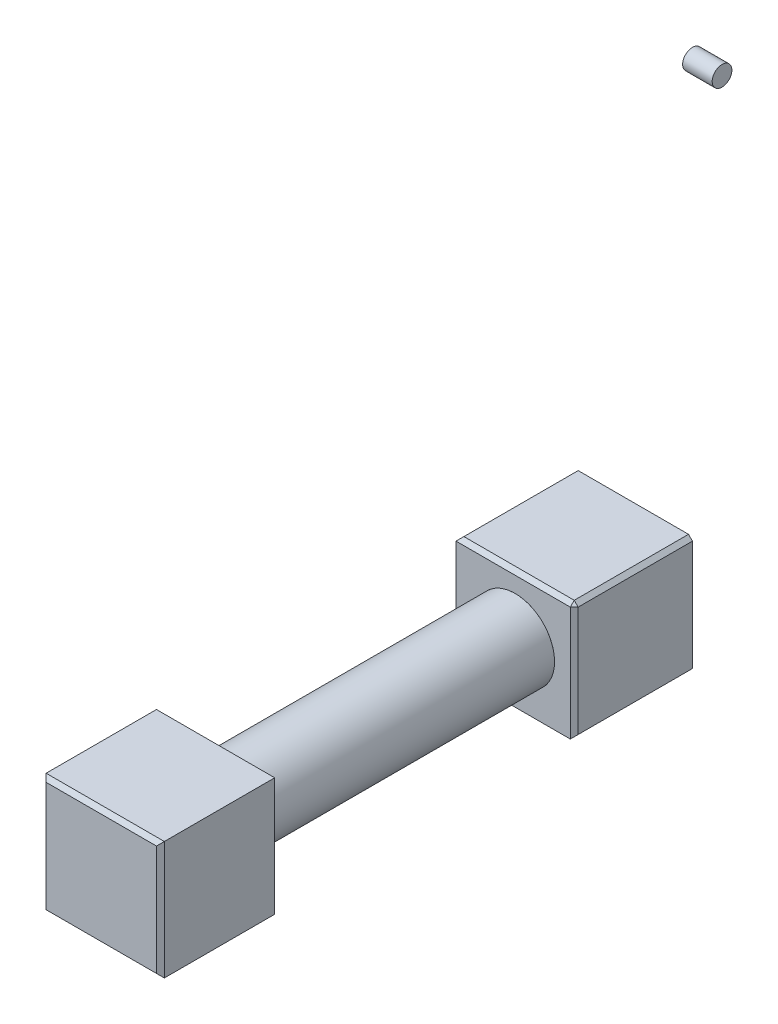
from build123d import *

# Parameters (mm, degrees)
SKETCH1_W           = 60
SKETCH1_H           = 60
BOSS_EXTRUDE1_DEPTH = 60
SKETCH2_R           = 20
CUT_EXTRUDE1_DEPTH  = 61
SKETCH3_R           = 20
BOSS_EXTRUDE2_DEPTH = 150
SKETCH4_W           = 60
SKETCH4_H           = 60
BOSS_EXTRUDE3_DEPTH = 60
CHAMFER1_SIZE       = 2
CHAMFER3_SIZE       = 2
SKETCH5_R           = 5
BOSS_EXTRUDE4_DEPTH = 15


with BuildPart() as part:
    # Sketch1 → Boss-Extrude1 (new body)
    with BuildSketch(Plane.XY):
        Rectangle(SKETCH1_W, SKETCH1_H)
    extrude(amount=BOSS_EXTRUDE1_DEPTH)

    # Sketch2 → Cut-Extrude1 (cut)
    with BuildSketch(Plane.XY):
        Circle(SKETCH2_R)
    extrude(amount=CUT_EXTRUDE1_DEPTH, mode=Mode.SUBTRACT)

    # Chamfer1
    chamfer1_edges = [part.edges().sort_by_distance(p)[0] for p in [
        (-30, -30, 30),
        (-30, 30, 30),
        (30, -30, 30),
        (30, 30, 30),
        (30, 0, 60),
        (0, 30, 60),
    ]]
    chamfer(chamfer1_edges, length=CHAMFER1_SIZE)


with BuildPart() as body_2:
    # Sketch3 → Boss-Extrude2 (new body)
    with BuildSketch(Plane.XY.offset(60)):
        Circle(SKETCH3_R)
    extrude(amount=BOSS_EXTRUDE2_DEPTH)

    # Sketch4 → Boss-Extrude3 (add)
    with BuildSketch(Plane.XY.offset(210)):
        Rectangle(SKETCH4_W, SKETCH4_H)
    extrude(amount=BOSS_EXTRUDE3_DEPTH)

    # Chamfer3
    chamfer3_edges = [body_2.edges().sort_by_distance(p)[0] for p in [
        (0, -30, 270),
        (-30, 0, 270),
        (0, 30, 270),
        (30, 0, 270),
        (-30, 0, 210),
        (0, 30, 210),
        (30, 0, 210),
    ]]
    chamfer(chamfer3_edges, length=CHAMFER3_SIZE)


with BuildPart() as body_3:
    # Sketch5 → Boss-Extrude4 (new body)
    with BuildSketch(Plane(origin=(30, 0, 0), x_dir=(0, 0, -1), z_dir=(1, 0, 0))):
        with Locations((0, 240)):
            Circle(SKETCH5_R)
    extrude(amount=BOSS_EXTRUDE4_DEPTH)


solid = Compound([part.part, body_2.part, body_3.part])
